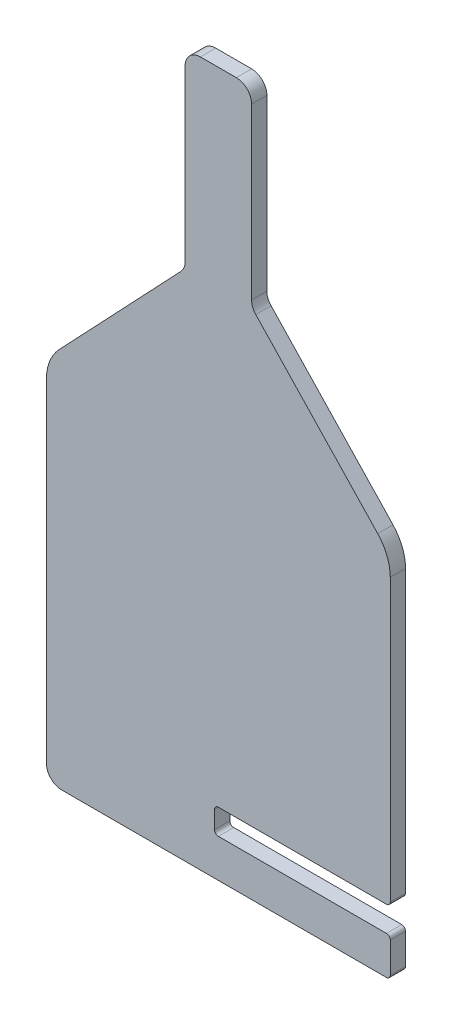
from build123d import *

# Parameters (mm, degrees)
SALIENTE_EXTRUIR1_DEPTH = 2
CROQUIS3_W              = 23
CROQUIS3_H              = 3.3
CORTAR_EXTRUIR2_DEPTH   = 2
REDONDEO1_R             = 2
REDONDEO2_R             = 6
REDONDEO3_R             = 0.5


with BuildPart() as part:
    # Croquis1 → Saliente-Extruir1 (new body)
    with BuildSketch(Plane.XY):
        Polygon((-4.35, 20), (-22.5, 0.828732436), (-22.5, -47.171267564), (22.5, -47.171267564), (22.5, 0.828732436), (4.35, 19.999005159), (4.35, 45), (-4.35, 45), align=None)
    extrude(amount=SALIENTE_EXTRUIR1_DEPTH)

    # Croquis3 → Cortar-Extruir2 (cut)
    with BuildSketch(Plane.XY.offset(2)):
        with Locations((11, -40.521267564)):
            Rectangle(CROQUIS3_W, CROQUIS3_H)
    extrude(amount=-CORTAR_EXTRUIR2_DEPTH, mode=Mode.SUBTRACT)

    # Redondeo1
    redondeo1_edges = [part.edges().sort_by_distance(p)[0] for p in [
        (-4.35, 45, 1),
        (-4.35, 20, 1),
        (-22.5, -47.171267564, 1),
        (4.35, 19.999005159, 1),
        (4.35, 45, 1),
    ]]
    fillet(redondeo1_edges, radius=REDONDEO1_R)

    # Redondeo2
    redondeo2_edges = [part.edges().sort_by_distance(p)[0] for p in [
        (-22.5, 0.828732436, 1),
        (22.5, 0.828732436, 1),
    ]]
    fillet(redondeo2_edges, radius=REDONDEO2_R)

    # Redondeo3
    redondeo3_edges = [part.edges().sort_by_distance(p)[0] for p in [
        (22.5, -47.171267564, 1),
        (-0.5, -38.871267564, 1),
        (-0.5, -42.171267564, 1),
        (22.5, -42.171267564, 1),
        (22.5, -38.871267564, 1),
    ]]
    fillet(redondeo3_edges, radius=REDONDEO3_R)


solid = part.part
